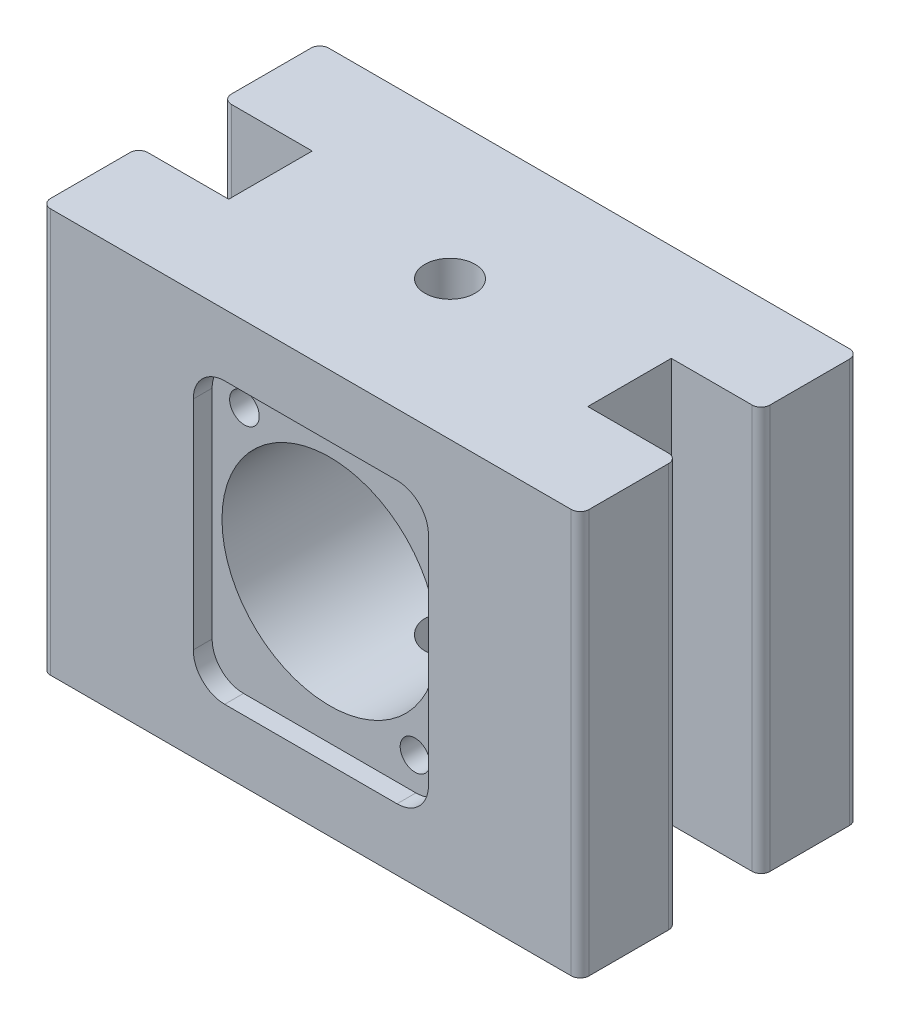
from build123d import *

# Parameters (mm, degrees)
SKETCH1_R           = 2.8
BOSS_EXTRUDE1_DEPTH = 45
SKETCH2_R           = 12
SKETCH2_R_2         = 1.65
CUT_EXTRUDE1_DEPTH  = 56
CUT_EXTRUDE2_DEPTH  = 2.1


with BuildPart() as part:
    # Sketch1 → Boss-Extrude1 (new body)
    with BuildSketch(Plane(origin=(0, 0, 0), x_dir=(1, 0, 0), z_dir=(0, 1, 0))):
        with BuildLine():
            Line((20, -4.65), (20, 4.65))
            Line((20, 4.65), (29, 4.65))
            ThreePointArc((29, 4.65), (29.707106781, 4.942893219), (30, 5.65))
            Line((30, 5.65), (30, 14.5))
            ThreePointArc((30, 14.5), (29.707106781, 15.207106781), (29, 15.5))
            Line((29, 15.5), (20, 15.5))
            Line((20, 15.5), (-20, 15.5))
            Line((-20, 15.5), (-29, 15.5))
            ThreePointArc((-29, 15.5), (-29.707106781, 15.207106781), (-30, 14.5))
            Line((-30, 14.5), (-30, 5.65))
            ThreePointArc((-30, 5.65), (-29.707106781, 4.942893219), (-29, 4.65))
            Line((-29, 4.65), (-20, 4.65))
            Line((-20, 4.65), (-20, -4.65))
            Line((-20, -4.65), (-29, -4.65))
            ThreePointArc((-29, -4.65), (-29.707106781, -4.942893219), (-30, -5.65))
            Line((-30, -5.65), (-30, -14.5))
            ThreePointArc((-30, -14.5), (-29.707106781, -15.207106781), (-29, -15.5))
            Line((-29, -15.5), (-20, -15.5))
            Line((-20, -15.5), (20, -15.5))
            Line((20, -15.5), (29, -15.5))
            ThreePointArc((29, -15.5), (29.707106781, -15.207106781), (30, -14.5))
            Line((30, -14.5), (30, -5.65))
            ThreePointArc((30, -5.65), (29.707106781, -4.942893219), (29, -4.65))
            Line((29, -4.65), (20, -4.65))
        make_face()
        with Locations(Location((0, 0, 0), (0, 0, 90))):
            Circle(SKETCH1_R, mode=Mode.SUBTRACT)
    extrude(amount=BOSS_EXTRUDE1_DEPTH)

    # Sketch2 → Cut-Extrude1 (cut)
    with BuildSketch(Plane.XY.offset(15.5)):
        with Locations((0, 22.5)):
            Circle(SKETCH2_R)
        with Locations((-9.5, 34.5)):
            Circle(SKETCH2_R_2)
        with Locations((9.5, 10.5)):
            Circle(SKETCH2_R_2)
    extrude(amount=-CUT_EXTRUDE1_DEPTH, mode=Mode.SUBTRACT)

    # Sketch3 → Cut-Extrude2 (cut)
    with BuildSketch(Plane.XY.offset(15.5)):
        with BuildLine():
            Line((-9.6, 38.1), (9.6, 38.1))
            ThreePointArc((9.6, 38.1), (12.074873734, 37.074873734), (13.1, 34.6))
            Line((13.1, 34.6), (13.1, 10.4))
            ThreePointArc((13.1, 10.4), (12.074873734, 7.925126266), (9.6, 6.9))
            Line((9.6, 6.9), (-9.6, 6.9))
            ThreePointArc((-9.6, 6.9), (-12.074873734, 7.925126266), (-13.1, 10.4))
            Line((-13.1, 10.4), (-13.1, 34.6))
            ThreePointArc((-13.1, 34.6), (-12.074873734, 37.074873734), (-9.6, 38.1))
        make_face()
    extrude(amount=-CUT_EXTRUDE2_DEPTH, mode=Mode.SUBTRACT)


solid = part.part
